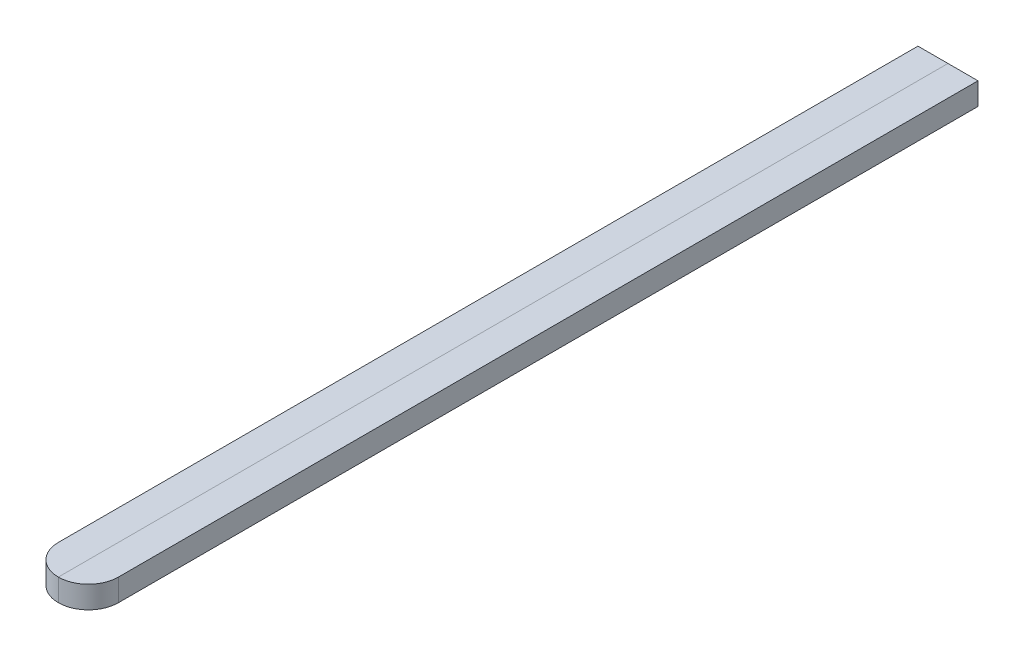
from build123d import *

# Parameters (mm, degrees)
SKETCH1_W           = 6.858
SKETCH1_H           = 2.54
BOSS_EXTRUDE1_DEPTH = 101.6
CUT_EXTRUDE1_REACH  = 103.863


with BuildPart() as part:
    # Sketch1 → Boss-Extrude1 (new body)
    with BuildSketch(Plane.XY):
        with Locations((3.429, 1.27)):
            Rectangle(SKETCH1_W, SKETCH1_H)
    extrude(amount=BOSS_EXTRUDE1_DEPTH)

    # Sketch2 → Cut-Extrude1 (cut, up to next)
    with BuildSketch(Plane(origin=(0, 2.54, 0), x_dir=(1, 0, 0), z_dir=(0, 1, 0)), mode=Mode.PRIVATE) as cut_extrude1_sk1:
        with BuildLine():
            Line((0, -101.6), (3.429, -101.6))
            ThreePointArc((3.429, -101.6), (1.004330847, -100.595669153), (0, -98.171))
            Line((0, -98.171), (0, -101.6))
        make_face()
    cut_extrude1_tool1 = extrude(cut_extrude1_sk1.sketch, amount=-CUT_EXTRUDE1_REACH, mode=Mode.PRIVATE) & part.part
    # Sketch2 → Cut-Extrude1 (cut, up to next)
    with BuildSketch(Plane(origin=(0, 2.54, 0), x_dir=(1, 0, 0), z_dir=(0, 1, 0)), mode=Mode.PRIVATE) as cut_extrude1_sk2:
        with BuildLine():
            Line((6.858, -101.6), (6.858, -98.171))
            ThreePointArc((6.858, -98.171), (5.853669153, -100.595669153), (3.429, -101.6))
            Line((3.429, -101.6), (6.858, -101.6))
        make_face()
    cut_extrude1_tool2 = extrude(cut_extrude1_sk2.sketch, amount=-CUT_EXTRUDE1_REACH, mode=Mode.PRIVATE) & part.part
    add(cut_extrude1_tool1.solids().sort_by_distance((0.765929, 2.54, 100.834071))[0], mode=Mode.SUBTRACT)
    add(cut_extrude1_tool2.solids().sort_by_distance((6.092071, 2.54, 100.834071))[0], mode=Mode.SUBTRACT)


with BuildPart() as body_2:
    # Split1: the piece on the far side of the plane
    add(part.part)
    split(bisect_by=Plane(origin=(3.429, 0, 0), x_dir=(0, 0, 1), z_dir=(1, 0, 0)), keep=Keep.BOTTOM)


with BuildPart() as part_1:
    add(part.part)

    # Split1
    split(bisect_by=Plane(origin=(3.429, 0, 0), x_dir=(0, 0, 1), z_dir=(1, 0, 0)), keep=Keep.TOP)


solid = Compound([body_2.part, part_1.part])
